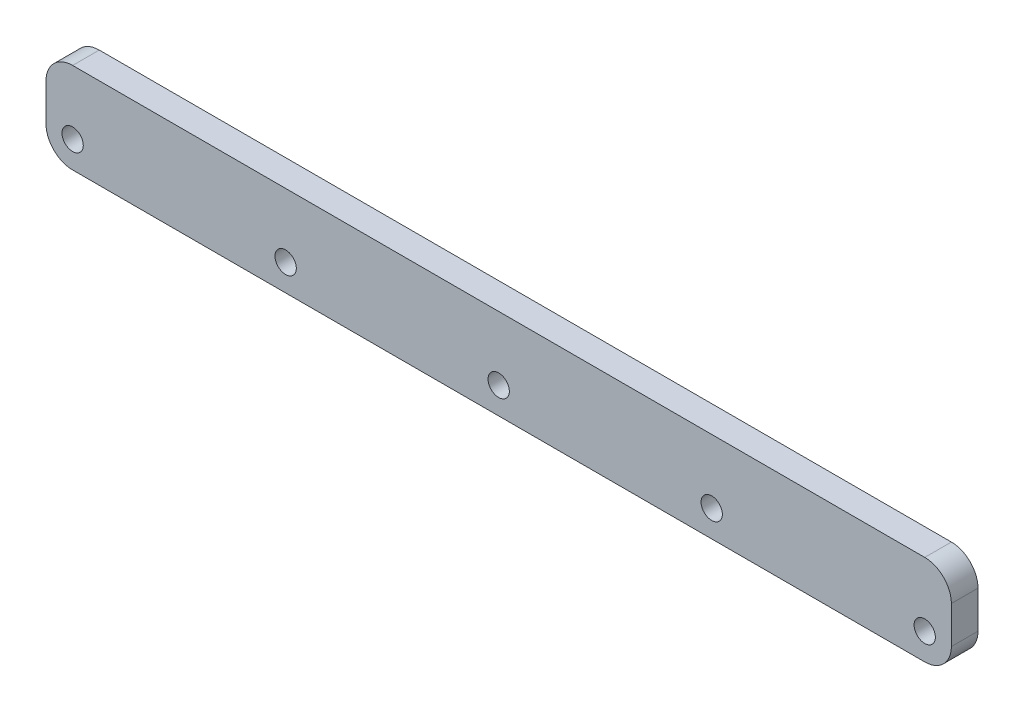
from build123d import *

# Parameters (mm, degrees)
ESQUISSE1_W        = 170
ESQUISSE1_H        = 17
ESQUISSE1_R        = 2
BOSS_EXTRU_1_DEPTH = 5
CONG_1_R           = 5


with BuildPart() as part:
    # Esquisse1 → Boss.-Extru.1 (new body)
    with BuildSketch(Plane.XY):
        with Locations((85, 8.5)):
            Rectangle(ESQUISSE1_W, ESQUISSE1_H)
        with Locations((5, 5)):
            Circle(ESQUISSE1_R, mode=Mode.SUBTRACT)
        with Locations((45, 5)):
            Circle(ESQUISSE1_R, mode=Mode.SUBTRACT)
        with Locations((85, 5)):
            Circle(ESQUISSE1_R, mode=Mode.SUBTRACT)
        with Locations((125, 5)):
            Circle(ESQUISSE1_R, mode=Mode.SUBTRACT)
        with Locations((165, 5)):
            Circle(ESQUISSE1_R, mode=Mode.SUBTRACT)
    extrude(amount=BOSS_EXTRU_1_DEPTH)

    # Congé1
    cong_1_edges = [part.edges().sort_by_distance(p)[0] for p in [
        (0, 17, 2.5),
        (170, 17, 2.5),
        (170, 0, 2.5),
        (0, 0, 2.5),
    ]]
    fillet(cong_1_edges, radius=CONG_1_R)


solid = part.part
